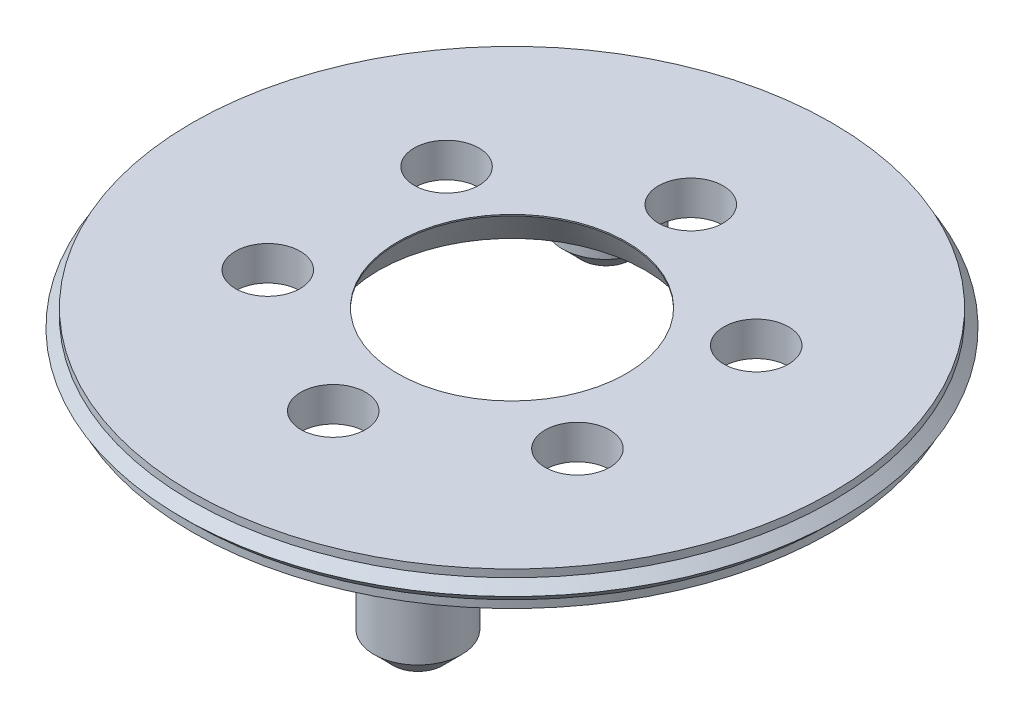
from build123d import *

# Parameters (mm, degrees)
SKETCH2_R           = 1.7
CUT_EXTRUDE1_DEPTH  = 25.532019892
SKETCH3_R           = 2.3
BOSS_EXTRUDE1_DEPTH = 4.6
CHAMFER1_SIZE       = 1
CHAMFER2_SIZE       = 1
CHAMFER2_SIZE2      = 1.732050808


with BuildPart() as part:
    # Sketch1 → Revolve1 (revolve)
    with BuildSketch(Plane.XY):
        Polygon((6, -0.9), (16.8, -0.9), (16.8, -0.5), (17.3, 0), (16.8, 0.5), (16.8, 0.9), (6, 0.9), align=None)
    revolve(axis=Axis((0, -175.207382849, 0), (0, 1, 0)))

    # Sketch2 → Cut-Extrude1 (cut, through all)
    with BuildSketch(Plane(origin=(0, 0.9, 0), x_dir=(1, 0, 0), z_dir=(0, 1, 0))):
        with Locations(Location((0, 9.385, 0), (0, 0, 180))):
            Circle(SKETCH2_R)
        with Locations(Location((8.127648415, 4.6925, 0), (0, 0, 180))):
            Circle(SKETCH2_R)
        with Locations(Location((8.127648415, -4.6925, 0), (0, 0, 180))):
            Circle(SKETCH2_R)
        with Locations(Location((0, -9.385, 0), (0, 0, 180))):
            Circle(SKETCH2_R)
        with Locations(Location((-8.127648415, -4.6925, 0), (0, 0, 180))):
            Circle(SKETCH2_R)
        with Locations(Location((-8.127648415, 4.6925, 0), (0, 0, 180))):
            Circle(SKETCH2_R)
    extrude(amount=-CUT_EXTRUDE1_DEPTH, mode=Mode.SUBTRACT)

    # Sketch3 → Boss-Extrude1 (add)
    with BuildSketch(Plane.XZ.offset(0.9)):
        with Locations((6.75, 11.691342951)):
            Circle(SKETCH3_R)
        with Locations((-6.75, -11.691342951)):
            Circle(SKETCH3_R)
    extrude(amount=BOSS_EXTRUDE1_DEPTH)

    # Chamfer1
    chamfer1_edges = [part.edges().sort_by_distance(p)[0] for p in [
        (4.45, -5.5, 11.691342951),
        (-9.05, -5.5, -11.691342951),
    ]]
    chamfer(chamfer1_edges, length=CHAMFER1_SIZE)

    # Chamfer2
    chamfer2_edges = [part.edges().sort_by_distance(p)[0] for p in [
        (-6, -0.9, 0),
    ]]
    chamfer2_side = [part.faces().sort_by_distance(p)[0] for p in [
        (-16.324824243, -0.9, 0),
    ]]
    chamfer(chamfer2_edges, length=CHAMFER2_SIZE, length2=CHAMFER2_SIZE2, reference=chamfer2_side[0])


solid = part.part
